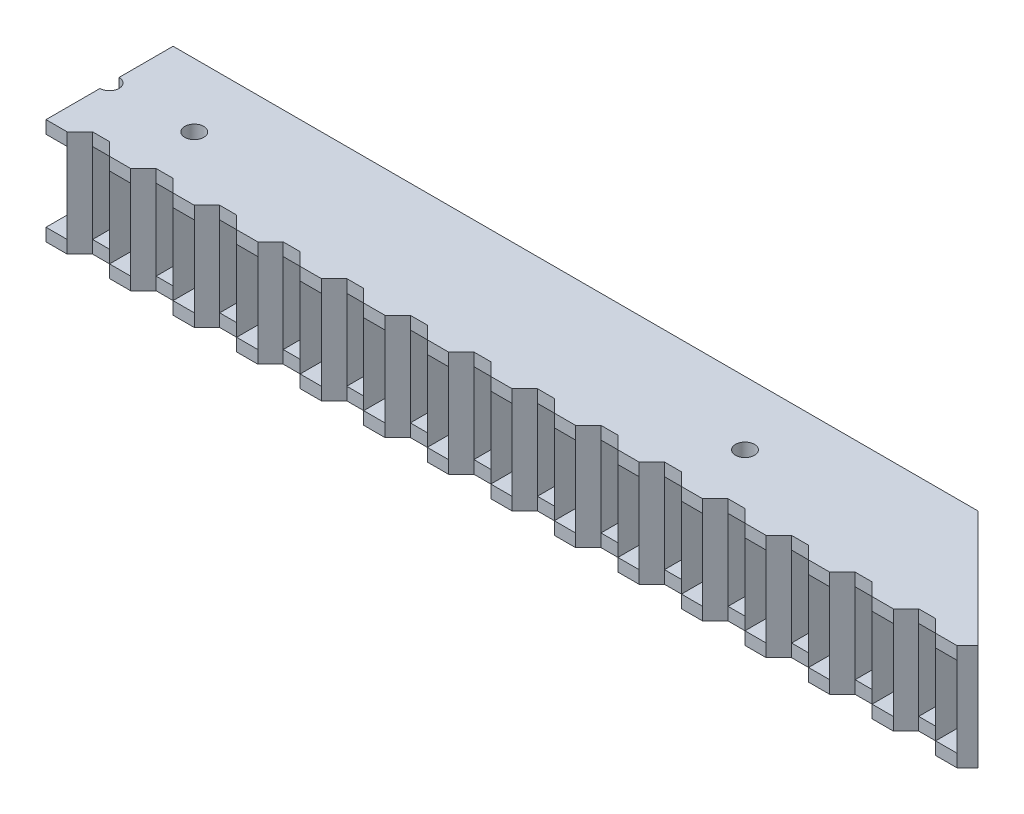
from build123d import *

# Parameters (mm, degrees)
SKETCH3_R           = 2.25
BOSS_EXTRUDE2_DEPTH = 25
CUT_EXTRUDE2_DEPTH  = 54
SKETCH7_W           = 4
SKETCH7_H           = 19
CUT_EXTRUDE3_DEPTH  = 54
SKETCH8_W           = 5
SKETCH8_H           = 19
CUT_EXTRUDE4_DEPTH  = 54
BOSS_EXTRUDE3_START = -25
SKETCH9_R           = 7.5
SKETCH9_R_2         = 2.25
BOSS_EXTRUDE3_DEPTH = 25


with BuildPart() as part:
    # Sketch3 → Boss-Extrude2 (new body)
    with BuildSketch(Plane(origin=(0, 0, 0), x_dir=(1, 0, 0), z_dir=(0, 1, 0))):
        with BuildLine():
            Line((0, 12.75), (0, 0))
            Line((0, 0), (220, 0))
            Line((220, 0), (190, 30))
            Line((190, 30), (0, 30))
            Line((0, 30), (0, 17.25))
            ThreePointArc((0, 17.25), (1.590990258, 16.590990258), (2.25, 15))
            ThreePointArc((2.25, 15), (1.590990258, 13.409009742), (0, 12.75))
        make_face()
        with Locations(Location((20, 15, 0), (0, 0, 270))):
            Circle(SKETCH3_R, mode=Mode.SUBTRACT)
        with Locations(Location((150, 15, 0), (0, 0, 270))):
            Circle(SKETCH3_R, mode=Mode.SUBTRACT)
    extrude(amount=BOSS_EXTRUDE2_DEPTH)

    # Sketch6 → Cut-Extrude2 (cut)
    with BuildSketch(Plane(origin=(0, 25, 0), x_dir=(1, 0, 0), z_dir=(0, 1, 0))):
        Polygon((0, 0), (5, 0), (8, 3), (12, 3), (15, 0), (20, 0), (23, 3), (27, 3), (30, 0), (35, 0), (38, 3), (42, 3), (45, 0), (50, 0), (53, 3), (57, 3), (60, 0), (65, 0), (68, 3), (72, 3), (75, 0), (80, 0), (83, 3), (87, 3), (90, 0), (95, 0), (98, 3), (102, 3), (105, 0), (110, 0), (113, 3), (117, 3), (120, 0), (125, 0), (128, 3), (132, 3), (135, 0), (140, 0), (143, 3), (147, 3), (150, 0), (155, 0), (158, 3), (162, 3), (165, 0), (170, 0), (173, 3), (177, 3), (180, 0), (185, 0), (188, 3), (192, 3), (195, 0), (200, 0), (203, 3), (207, 3), (210, 0), (215, 0), (218, 3), (222, 3), (225, 0), (225, -19.034705474), (0, -19.034705474), align=None)
    extrude(amount=-CUT_EXTRUDE2_DEPTH, mode=Mode.SUBTRACT)

    # Sketch7 → Cut-Extrude3 (cut)
    with BuildSketch(Plane.XY.offset(-3)):
        with Locations((10, 12.5)):
            Rectangle(SKETCH7_W, SKETCH7_H)
        with Locations((25, 12.5)):
            Rectangle(SKETCH7_W, SKETCH7_H)
        with Locations((40, 12.5)):
            Rectangle(SKETCH7_W, SKETCH7_H)
        with Locations((55, 12.5)):
            Rectangle(SKETCH7_W, SKETCH7_H)
        with Locations((70, 12.5)):
            Rectangle(SKETCH7_W, SKETCH7_H)
        with Locations((85, 12.5)):
            Rectangle(SKETCH7_W, SKETCH7_H)
        with Locations((100, 12.5)):
            Rectangle(SKETCH7_W, SKETCH7_H)
        with Locations((115, 12.5)):
            Rectangle(SKETCH7_W, SKETCH7_H)
        with Locations((130, 12.5)):
            Rectangle(SKETCH7_W, SKETCH7_H)
        with Locations((145, 12.5)):
            Rectangle(SKETCH7_W, SKETCH7_H)
        with Locations((160, 12.5)):
            Rectangle(SKETCH7_W, SKETCH7_H)
        with Locations((175, 12.5)):
            Rectangle(SKETCH7_W, SKETCH7_H)
        with Locations((190, 12.5)):
            Rectangle(SKETCH7_W, SKETCH7_H)
        with Locations((205, 12.5)):
            Rectangle(SKETCH7_W, SKETCH7_H)
        with Locations((220, 12.5)):
            Rectangle(SKETCH7_W, SKETCH7_H)
    extrude(amount=-CUT_EXTRUDE3_DEPTH, mode=Mode.SUBTRACT)

    # Sketch8 → Cut-Extrude4 (cut)
    with BuildSketch(Plane.XY):
        with Locations((2.5, 12.5)):
            Rectangle(SKETCH8_W, SKETCH8_H)
        with Locations((17.5, 12.5)):
            Rectangle(SKETCH8_W, SKETCH8_H)
        with Locations((32.5, 12.5)):
            Rectangle(SKETCH8_W, SKETCH8_H)
        with Locations((47.5, 12.5)):
            Rectangle(SKETCH8_W, SKETCH8_H)
        with Locations((62.5, 12.5)):
            Rectangle(SKETCH8_W, SKETCH8_H)
        with Locations((77.5, 12.5)):
            Rectangle(SKETCH8_W, SKETCH8_H)
        with Locations((92.5, 12.5)):
            Rectangle(SKETCH8_W, SKETCH8_H)
        with Locations((107.5, 12.5)):
            Rectangle(SKETCH8_W, SKETCH8_H)
        with Locations((122.5, 12.5)):
            Rectangle(SKETCH8_W, SKETCH8_H)
        with Locations((137.5, 12.5)):
            Rectangle(SKETCH8_W, SKETCH8_H)
        with Locations((152.5, 12.5)):
            Rectangle(SKETCH8_W, SKETCH8_H)
        with Locations((167.5, 12.5)):
            Rectangle(SKETCH8_W, SKETCH8_H)
        with Locations((182.5, 12.5)):
            Rectangle(SKETCH8_W, SKETCH8_H)
        with Locations((197.5, 12.5)):
            Rectangle(SKETCH8_W, SKETCH8_H)
        with Locations((212.5, 12.5)):
            Rectangle(SKETCH8_W, SKETCH8_H)
    extrude(amount=-CUT_EXTRUDE4_DEPTH, mode=Mode.SUBTRACT)

    # Sketch9 → Boss-Extrude3 (add)
    # profile 1 of 3: a face of its own
    with BuildSketch(Plane(origin=(0, 25, 0), x_dir=(1, 0, 0), z_dir=(0, 1, 0)).offset(BOSS_EXTRUDE3_START)):
        with Locations((20, 15)):
            Circle(SKETCH9_R)
        with Locations(Location((20, 15, 0), (0, 0, 270))):
            Circle(SKETCH9_R_2, mode=Mode.SUBTRACT)
    # profile 2 of 3: a face of its own
    with BuildSketch(Plane(origin=(0, 25, 0), x_dir=(1, 0, 0), z_dir=(0, 1, 0)).offset(BOSS_EXTRUDE3_START)):
        with Locations((150, 15)):
            Circle(SKETCH9_R)
        with Locations(Location((150, 15, 0), (0, 0, 270))):
            Circle(SKETCH9_R_2, mode=Mode.SUBTRACT)
    # profile 3 of 3: a face of its own
    with BuildSketch(Plane(origin=(0, 25, 0), x_dir=(1, 0, 0), z_dir=(0, 1, 0)).offset(BOSS_EXTRUDE3_START)):
        with BuildLine():
            Line((0, 22.5), (0, 17.25))
            ThreePointArc((0, 17.25), (2.25, 15), (0, 12.75))
            Line((0, 12.75), (0, 7.5))
            ThreePointArc((0, 7.5), (7.5, 15), (0, 22.5))
        make_face()
    extrude(amount=BOSS_EXTRUDE3_DEPTH)


solid = part.part
